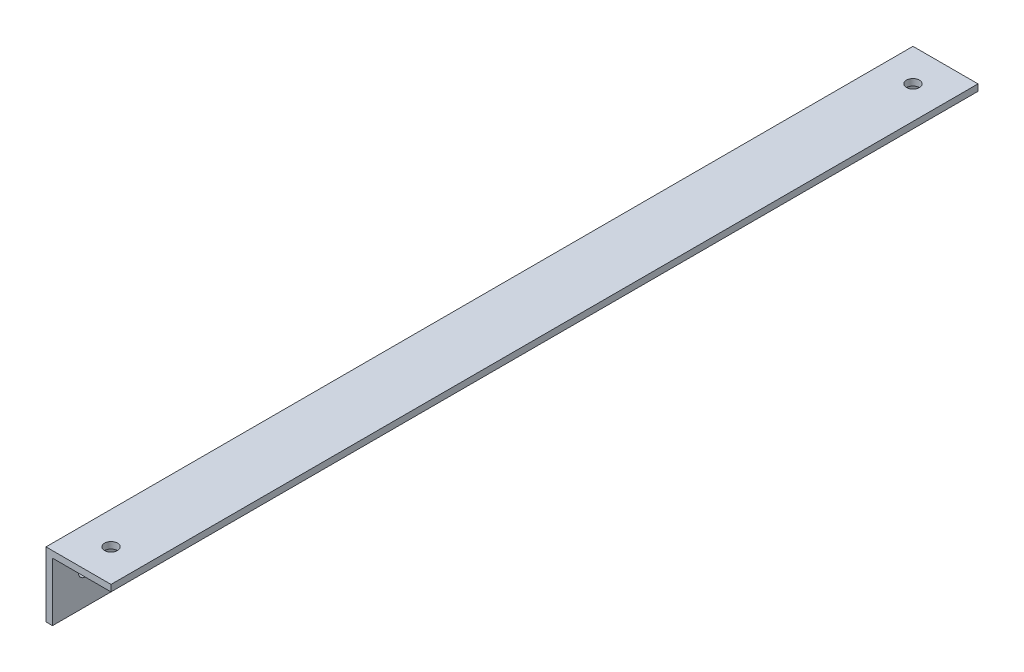
from build123d import *

# Parameters (mm, degrees)
EXTRUDE_THIN1_DEPTH = 400
SKETCH2_R           = 3
CUT_EXTRUDE1_DEPTH  = 10
LPATTERN1_COUNT     = 2
LPATTERN1_PITCH     = 370
SKETCH3_R           = 3
CUT_EXTRUDE2_DEPTH  = 10
LPATTERN2_COUNT     = 2
LPATTERN2_PITCH     = 370


with BuildPart() as part:
    # Sketch1 → Extrude-Thin1 (new body)
    with BuildSketch(Plane.XY):
        Polygon((0, 0), (-27, 0), (-27, -27), (-30, -27), (-30, 3), (0, 3), align=None)
    extrude(amount=EXTRUDE_THIN1_DEPTH)

    # Sketch2 → Cut-Extrude1 (cut)
    with BuildSketch(Plane(origin=(0, 3, 0), x_dir=(1, 0, 0), z_dir=(0, 1, 0))):
        with Locations(Location((-15, -15, 0), (0, 0, 270))):
            Circle(SKETCH2_R)
    cut_extrude1 = extrude(amount=-CUT_EXTRUDE1_DEPTH, mode=Mode.SUBTRACT)

    # LPattern1: Cut-Extrude1 ×2
    with Locations(*[(0, 0, i * LPATTERN1_PITCH) for i in range(1, LPATTERN1_COUNT)]):
        add(cut_extrude1, mode=Mode.SUBTRACT)

    # Sketch3 → Cut-Extrude2 (cut)
    with BuildSketch(Plane.ZY.offset(30)):
        with Locations((15, -12)):
            Circle(SKETCH3_R)
    cut_extrude2 = extrude(amount=-CUT_EXTRUDE2_DEPTH, mode=Mode.SUBTRACT)

    # LPattern2: Cut-Extrude2 ×2
    with Locations(*[(0, 0, i * LPATTERN2_PITCH) for i in range(1, LPATTERN2_COUNT)]):
        add(cut_extrude2, mode=Mode.SUBTRACT)


solid = part.part
